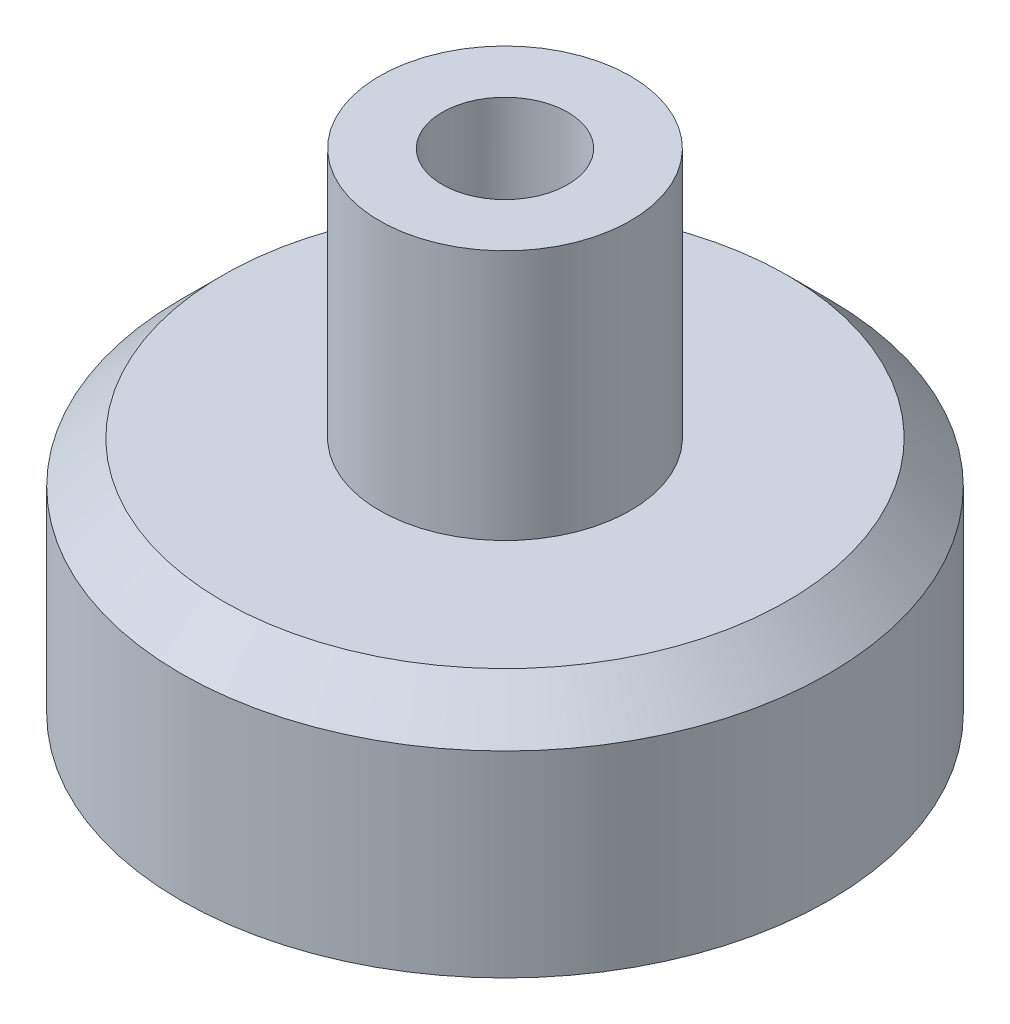
from build123d import *

# Parameters (mm, degrees)
CHAMFER1_SIZE = 2
CHAMFER2_SIZE = 2


with BuildPart() as part:
    # Sketch1 → Revolve1 (revolve)
    with BuildSketch(Plane.XY, mode=Mode.PRIVATE) as revolve1_sk:
        Polygon((-15.5, 0), (-15.5, 11.4), (-6, 11.4), (-6, 23.4), (-3, 23.4), (-3, 9.4), (-13.5, 9.4), (-13.5, 0), align=None)
    revolve(revolve1_sk.sketch.rotate(Axis((0, 0, 0), (0, 1, 0)), 270), axis=Axis((0, 0, 0), (0, 1, 0)))

    # Chamfer1
    chamfer1_edges = [part.edges().sort_by_distance(p)[0] for p in [
        (0, 9.4, 13.5),
        (0, 11.4, 15.5),
    ]]
    chamfer(chamfer1_edges, length=CHAMFER1_SIZE)

    # Chamfer2
    chamfer2_edges = [part.edges().sort_by_distance(p)[0] for p in [
        (0, 9.4, 3),
    ]]
    chamfer(chamfer2_edges, length=CHAMFER2_SIZE)


solid = part.part
